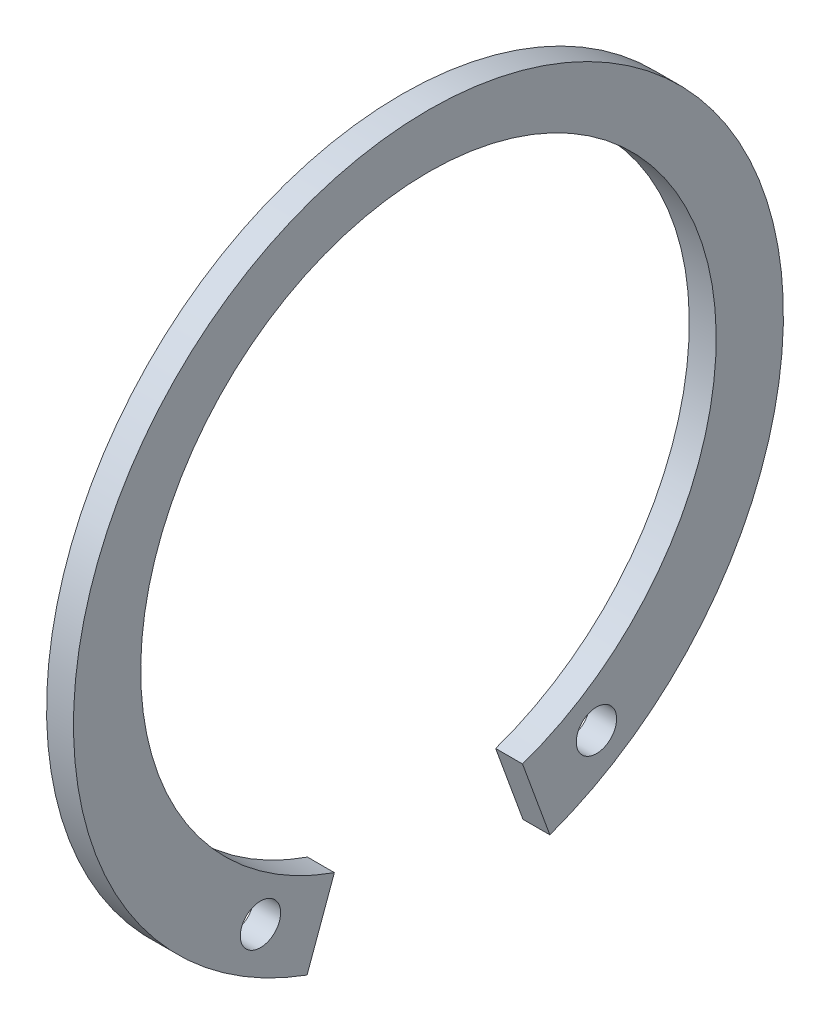
from build123d import *

# Parameters (mm, degrees)
SZKIC2_R                    = 0.75
DODANIE_WYCI_GNI_CIE1_DEPTH = 1


with BuildPart() as part:
    # Szkic2 → Dodanie-wyciągnięcie1 (new body)
    with BuildSketch(Plane(origin=(0, 0, 0), x_dir=(0, 0, -1), z_dir=(1, 0, 0))):
        with BuildLine():
            Line((-4.005055878, -11.003800589), (-3.498451209, -9.611915701))
            ThreePointArc((-3.498451209, -9.611915701), (0, 11.2), (3.498451209, -9.611915701))
            Line((3.498451209, -9.611915701), (4.514665892, -12.403942594))
            ThreePointArc((4.514665892, -12.403942594), (0, 13.2), (-4.514665892, -12.403942594))
            Line((-4.514665892, -12.403942594), (-4.006558551, -11.007929147))
            Line((-4.006558551, -11.007929147), (-4.043528072, -10.989721595))
            ThreePointArc((-4.043528072, -10.989721595), (-4.024298132, -10.996777916), (-4.005055878, -11.003800589))
        make_face()
        with Locations((-6.246932231, -9.904541267)):
            Circle(SZKIC2_R, mode=Mode.SUBTRACT)
        with Locations((6.24693223, -9.904541267)):
            Circle(SZKIC2_R, mode=Mode.SUBTRACT)
    extrude(amount=DODANIE_WYCI_GNI_CIE1_DEPTH)


solid = part.part
